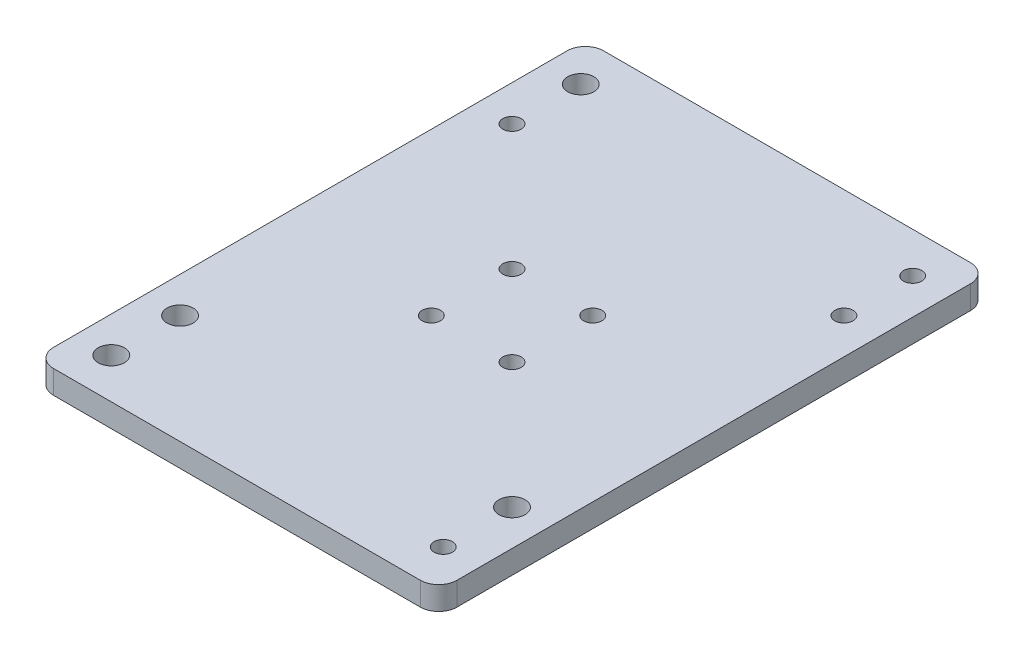
from build123d import *

# Parameters (mm, degrees)
SKETCH2_W           = 110
SKETCH2_H           = 150
SKETCH2_R           = 3.56
SKETCH2_R_2         = 2.5
BOSS_EXTRUDE1_DEPTH = 6.35
FILLET1_R           = 5


with BuildPart() as part:
    # Sketch2 → Boss-Extrude1 (new body)
    with BuildSketch(Plane(origin=(0, 0, 0), x_dir=(1, 0, 0), z_dir=(0, 1, 0))):
        Rectangle(SKETCH2_W, SKETCH2_H)
        with Locations(Location((-45.25, 64, 0), (0, 0, 270))):
            Circle(SKETCH2_R, mode=Mode.SUBTRACT)
        with Locations(Location((-45.25, -64, 0), (0, 0, 270))):
            Circle(SKETCH2_R, mode=Mode.SUBTRACT)
        with Locations(Location((45.25, 64, 0), (0, 0, 270))):
            Circle(SKETCH2_R_2, mode=Mode.SUBTRACT)
        with Locations(Location((45.25, -64, 0), (0, 0, 270))):
            Circle(SKETCH2_R_2, mode=Mode.SUBTRACT)
        with Locations(Location((-45.25, -45.25, 0), (0, 0, 270))):
            Circle(SKETCH2_R, mode=Mode.SUBTRACT)
        with Locations(Location((45.25, -45.25, 0), (0, 0, 270))):
            Circle(SKETCH2_R, mode=Mode.SUBTRACT)
        with Locations(Location((-45.25, 45.25, 0), (0, 0, 270))):
            Circle(SKETCH2_R_2, mode=Mode.SUBTRACT)
        with Locations(Location((45.25, 45.25, 0), (0, 0, 270))):
            Circle(SKETCH2_R_2, mode=Mode.SUBTRACT)
        with Locations(Location((-11, 11, 0), (0, 0, 270))):
            Circle(SKETCH2_R_2, mode=Mode.SUBTRACT)
        with Locations(Location((11, 11, 0), (0, 0, 270))):
            Circle(SKETCH2_R_2, mode=Mode.SUBTRACT)
        with Locations(Location((11, -11, 0), (0, 0, 270))):
            Circle(SKETCH2_R_2, mode=Mode.SUBTRACT)
        with Locations(Location((-11, -11, 0), (0, 0, 270))):
            Circle(SKETCH2_R_2, mode=Mode.SUBTRACT)
    extrude(amount=BOSS_EXTRUDE1_DEPTH)

    # Fillet1
    fillet1_edges = [part.edges().sort_by_distance(p)[0] for p in [
        (-55, 3.175, -75),
        (55, 3.175, -75),
        (55, 3.175, 75),
        (-55, 3.175, 75),
    ]]
    fillet(fillet1_edges, radius=FILLET1_R)


solid = part.part
